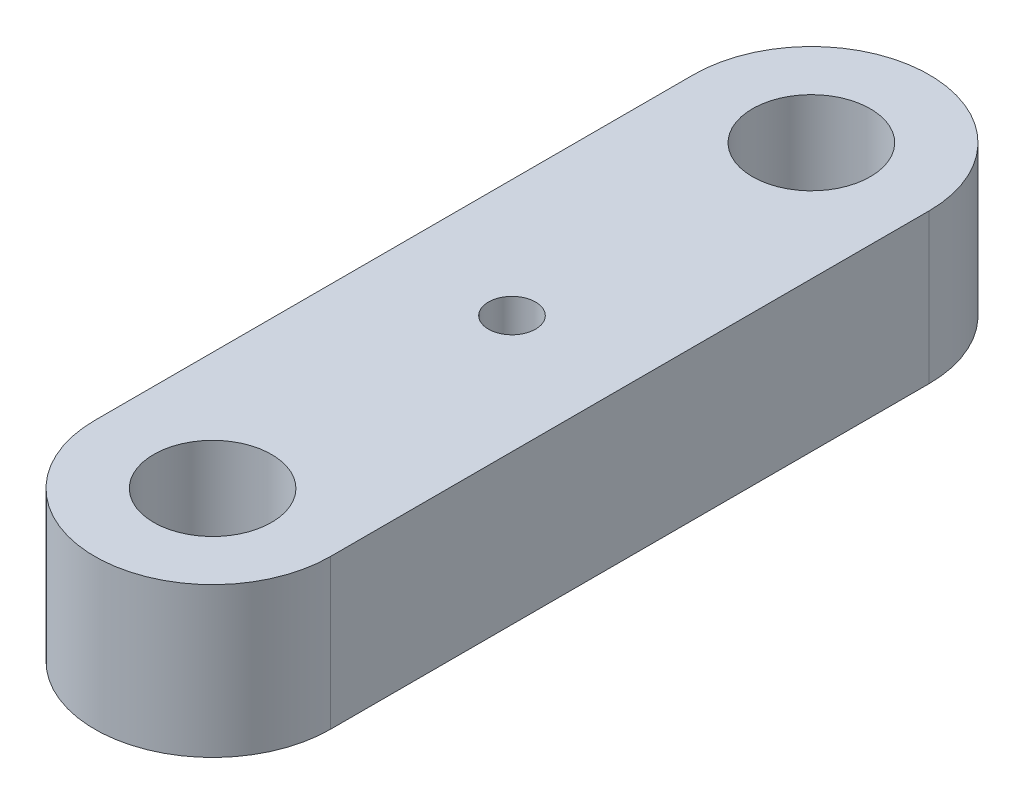
from build123d import *

# Parameters (mm, degrees)
SKETCH1_R           = 1.25
SKETCH1_R_2         = 0.5
BOSS_EXTRUDE1_DEPTH = 3.175


with BuildPart() as part:
    # Sketch1 → Boss-Extrude1 (new body)
    with BuildSketch(Plane(origin=(0, 0, 0), x_dir=(1, 0, 0), z_dir=(0, 1, 0))):
        with BuildLine():
            Line((-2.5, -6.35), (-2.5, 6.35))
            ThreePointArc((-2.5, 6.35), (0, 8.85), (2.5, 6.35))
            Line((2.5, 6.35), (2.5, -6.35))
            ThreePointArc((2.5, -6.35), (0, -8.85), (-2.5, -6.35))
        make_face()
        with Locations(Location((0, 6.35, 0), (0, 0, 270))):
            Circle(SKETCH1_R, mode=Mode.SUBTRACT)
        with Locations(Location((0, -6.35, 0), (0, 0, 270))):
            Circle(SKETCH1_R, mode=Mode.SUBTRACT)
        with Locations(Location((0, 0, 0), (0, 0, 270))):
            Circle(SKETCH1_R_2, mode=Mode.SUBTRACT)
    extrude(amount=BOSS_EXTRUDE1_DEPTH)


solid = part.part
